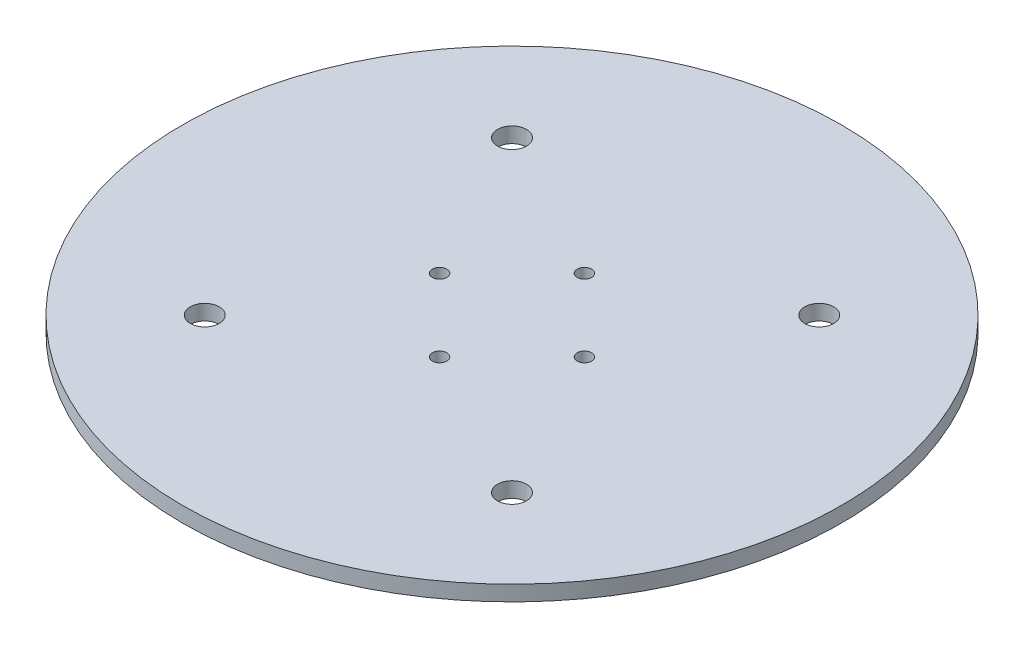
from build123d import *

# Parameters (mm, degrees)
SKETCH1_R           = 34.13125
BOSS_EXTRUDE1_DEPTH = 1.59
SKETCH2_R           = 0.75
CUT_EXTRUDE1_DEPTH  = 1.59
SKETCH3_R           = 1.5
CUT_EXTRUDE2_DEPTH  = 1.59


with BuildPart() as part:
    # Sketch1 → Boss-Extrude1 (new body)
    with BuildSketch(Plane(origin=(0, 0, 0), x_dir=(1, 0, 0), z_dir=(0, 1, 0))):
        with Locations(Location((0, 0, 0), (0, 0, 90))):
            Circle(SKETCH1_R)
    extrude(amount=BOSS_EXTRUDE1_DEPTH)

    # Sketch2 → Cut-Extrude1 (cut)
    with BuildSketch(Plane(origin=(0, 1.59, 0), x_dir=(1, 0, 0), z_dir=(0, 1, 0))):
        with Locations(Location((0, -7.5, 0), (0, 0, 270))):
            Circle(SKETCH2_R)
        with Locations(Location((0, 7.5, 0), (0, 0, 270))):
            Circle(SKETCH2_R)
        with Locations(Location((-7.5, 0, 0), (0, 0, 270))):
            Circle(SKETCH2_R)
        with Locations(Location((7.5, 0, 0), (0, 0, 270))):
            Circle(SKETCH2_R)
    extrude(amount=-CUT_EXTRUDE1_DEPTH, mode=Mode.SUBTRACT)

    # Sketch3 → Cut-Extrude2 (cut)
    with BuildSketch(Plane(origin=(0, 1.59, 0), x_dir=(1, 0, 0), z_dir=(0, 1, 0))):
        with Locations(Location((-15.909, 15.910805102, 0), (0, 0, 270))):
            Circle(SKETCH3_R)
        with Locations(Location((15.910805102, 15.909, 0), (0, 0, 270))):
            Circle(SKETCH3_R)
        with Locations(Location((15.909, -15.910805102, 0), (0, 0, 270))):
            Circle(SKETCH3_R)
        with Locations(Location((-15.910805102, -15.909, 0), (0, 0, 270))):
            Circle(SKETCH3_R)
    extrude(amount=-CUT_EXTRUDE2_DEPTH, mode=Mode.SUBTRACT)


solid = part.part
